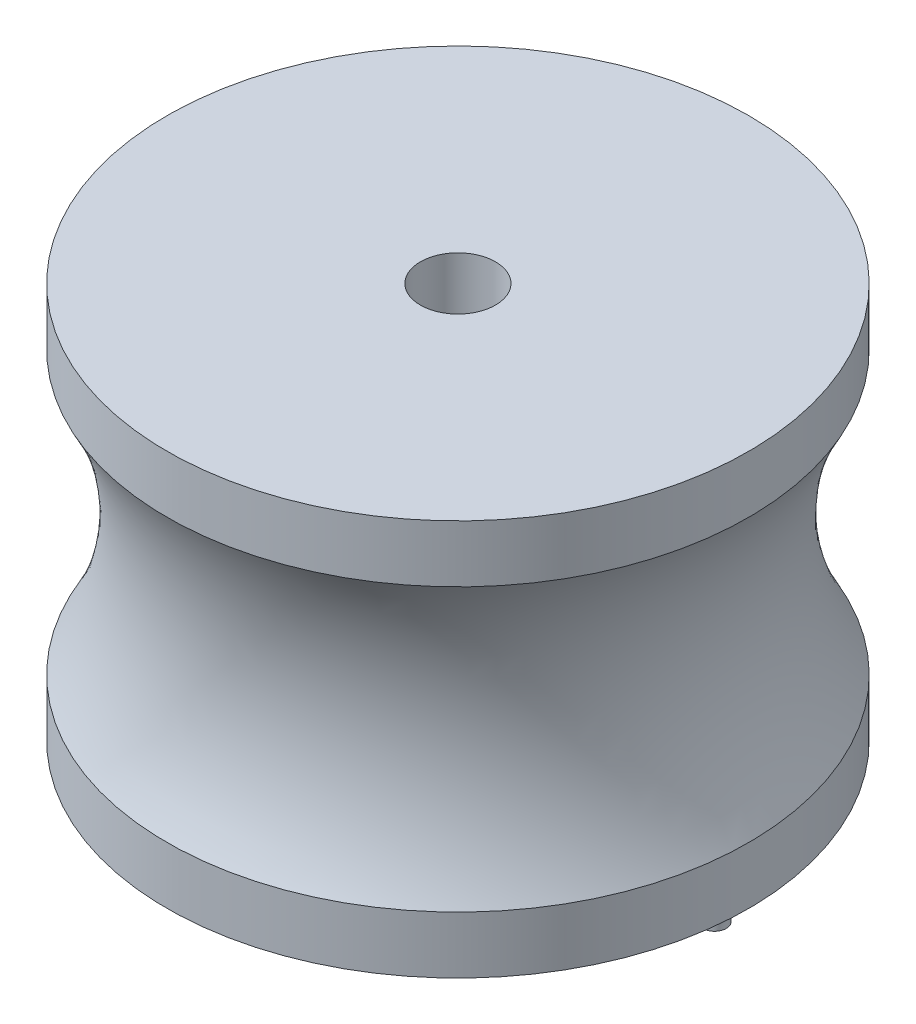
from build123d import *

# Parameters (mm, degrees)
SKETCH2_R           = 18.0975
BOSS_EXTRUDE1_DEPTH = 24.638
SKETCH3_R           = 2.3368
CUT_EXTRUDE1_DEPTH  = 36.52562535
SKETCH4_R           = 0.7239
BOSS_EXTRUDE2_DEPTH = 1.778


with BuildPart() as part:
    # Sketch2 → Boss-Extrude1 (new body)
    with BuildSketch(Plane(origin=(0, 0, 0), x_dir=(1, 0, 0), z_dir=(0, 1, 0))):
        with Locations(Location((0, 0, 0), (0, 0, 90))):
            Circle(SKETCH2_R)
    extrude(amount=BOSS_EXTRUDE1_DEPTH)

    # Sketch3 → Cut-Extrude1 (cut, through all)
    with BuildSketch(Plane(origin=(0, 24.638, 0), x_dir=(1, 0, 0), z_dir=(0, 1, 0))):
        with Locations(Location((0, 0, 0), (0, 0, 270))):
            Circle(SKETCH3_R)
    extrude(amount=-CUT_EXTRUDE1_DEPTH, mode=Mode.SUBTRACT)

    # Sketch4 → Boss-Extrude2 (add)
    with BuildSketch(Plane.XZ):
        with Locations(Location((15.972995617, 0, 0), (0, 0, 90))):
            Circle(SKETCH4_R)
        with Locations(Location((-16.847197726, 0, 0), (0, 0, 90))):
            Circle(SKETCH4_R)
    extrude(amount=BOSS_EXTRUDE2_DEPTH)

    # Sketch7 → Cut-Revolve1 (revolve, cut)
    with BuildSketch(Plane.XY, mode=Mode.PRIVATE) as cut_revolve1_sk:
        with BuildLine():
            Line((-18.0975, 21.082), (-18.0975, 3.556))
            ThreePointArc((-18.0975, 3.556), (-15.748, 12.319), (-18.0975, 21.082))
        make_face()
    revolve(cut_revolve1_sk.sketch.rotate(Axis((0, 24.735696044, 0), (0, -1, 0)), 90), axis=Axis((0, 24.735696044, 0), (0, -1, 0)), mode=Mode.SUBTRACT)


solid = part.part
